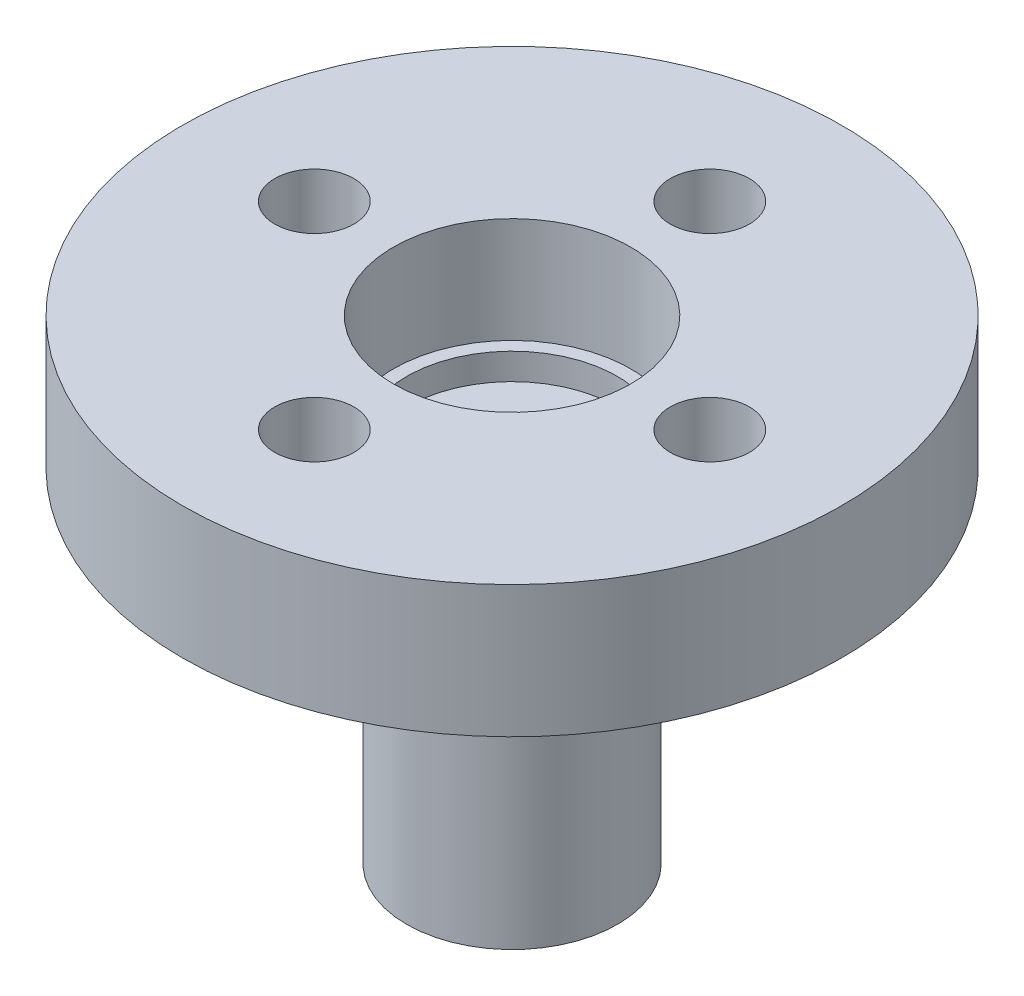
from build123d import *

# Parameters (mm, degrees)
SKETCH1_R                = 12.5
SKETCH1_R_2              = 1.5
SKETCH1_R_3              = 4.5
BOSS_EXTRUDE1_DEPTH      = 5
SKETCH1_3_R              = 4
BOSS_EXTRUDE2_DEPTH      = 13
BOSS_EXTRUDE3_DEPTH      = 1
BOSS_EXTRUDE3_DEPTH_BACK = 1
SKETCH1_4_R              = 4.5
SKETCH1_4_R_2            = 4


with BuildPart() as part:
    # Sketch1 → Boss-Extrude1 (new body)
    with BuildSketch(Plane(origin=(0, 0, 0), x_dir=(1, 0, 0), z_dir=(0, 1, 0))):
        Circle(SKETCH1_R)
        with Locations((-7.5, 0)):
            Circle(SKETCH1_R_2, mode=Mode.SUBTRACT)
        with Locations((0, -7.5)):
            Circle(SKETCH1_R_2, mode=Mode.SUBTRACT)
        Circle(SKETCH1_R_3, mode=Mode.SUBTRACT)
        with Locations((7.5, 0)):
            Circle(SKETCH1_R_2, mode=Mode.SUBTRACT)
        with Locations((0, 7.5)):
            Circle(SKETCH1_R_2, mode=Mode.SUBTRACT)
    extrude(amount=BOSS_EXTRUDE1_DEPTH)



with BuildPart() as body_2:
    # Sketch1<3> → Boss-Extrude2 (new body)
    with BuildSketch(Plane(origin=(0, 0, 0), x_dir=(1, 0, 0), z_dir=(0, 1, 0))):
        Circle(SKETCH1_3_R)
    extrude(amount=-BOSS_EXTRUDE2_DEPTH)


with BuildPart() as part_1:
    add(part.part)

    add(body_2.part)  # Boss-Extrude3 merges body 2
    # Sketch1<4> → Boss-Extrude3 (add, two sides: drawn at the far end of the back side and taken through both)
    with BuildSketch(Plane(origin=(0, 0, 0), x_dir=(1, 0, 0), z_dir=(0, 1, 0)).offset(-BOSS_EXTRUDE3_DEPTH_BACK)):
        Circle(SKETCH1_4_R)
        Circle(SKETCH1_4_R_2, mode=Mode.SUBTRACT)
    extrude(amount=BOSS_EXTRUDE3_DEPTH + BOSS_EXTRUDE3_DEPTH_BACK)


solid = part_1.part
